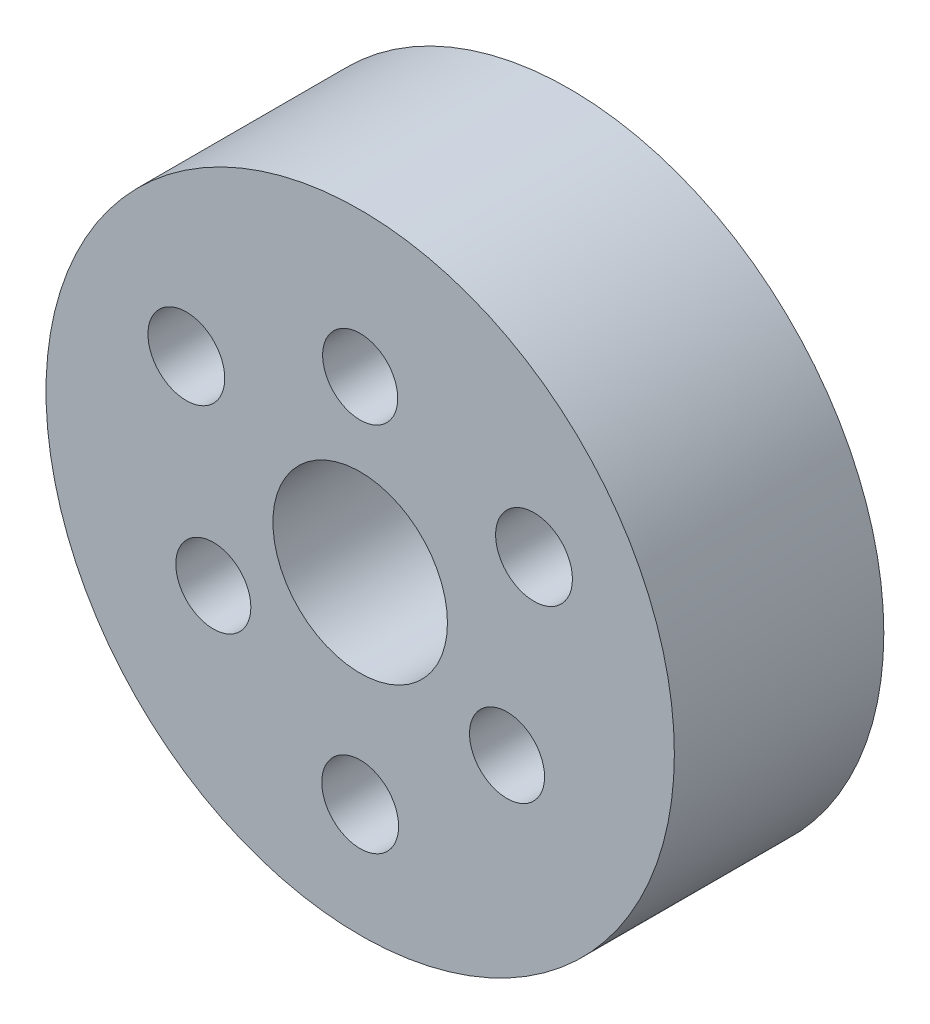
from build123d import *

# Parameters (mm, degrees)
SKETCH_1_R          = 18
EXTRUDE_1_DEPTH     = 12
SKETCH_3_R          = 2.15
SKETCH_3_R_2        = 2.2
CUT_EXTRUDE_1_DEPTH = 29.142494559
SKETCH_4_R          = 5
CUT_EXTRUDE_2_DEPTH = 29.142494559


with BuildPart() as part:
    # 草图1 → 凸台-拉伸1 (new body)
    with BuildSketch(Plane.XY):
        Circle(SKETCH_1_R)
    extrude(amount=EXTRUDE_1_DEPTH)

    # 草图3 → 切除-拉伸1 (cut, through all)
    with BuildSketch(Plane.XY.offset(12)):
        with Locations((0, 9.715)):
            Circle(SKETCH_3_R)
        with Locations((8.413436798, -4.8575)):
            Circle(SKETCH_3_R)
        with Locations((-8.413436798, -4.8575)):
            Circle(SKETCH_3_R)
        with Locations((9.959292144, 5.75)):
            Circle(SKETCH_3_R_2)
        with Locations((0, -11.5)):
            Circle(SKETCH_3_R_2)
        with Locations((-9.959292144, 5.75)):
            Circle(SKETCH_3_R_2)
    extrude(amount=-CUT_EXTRUDE_1_DEPTH, mode=Mode.SUBTRACT)

    # 草图4 → 切除-拉伸2 (cut, through all)
    with BuildSketch(Plane.XY.offset(12)):
        Circle(SKETCH_4_R)
    extrude(amount=-CUT_EXTRUDE_2_DEPTH, mode=Mode.SUBTRACT)


solid = part.part
